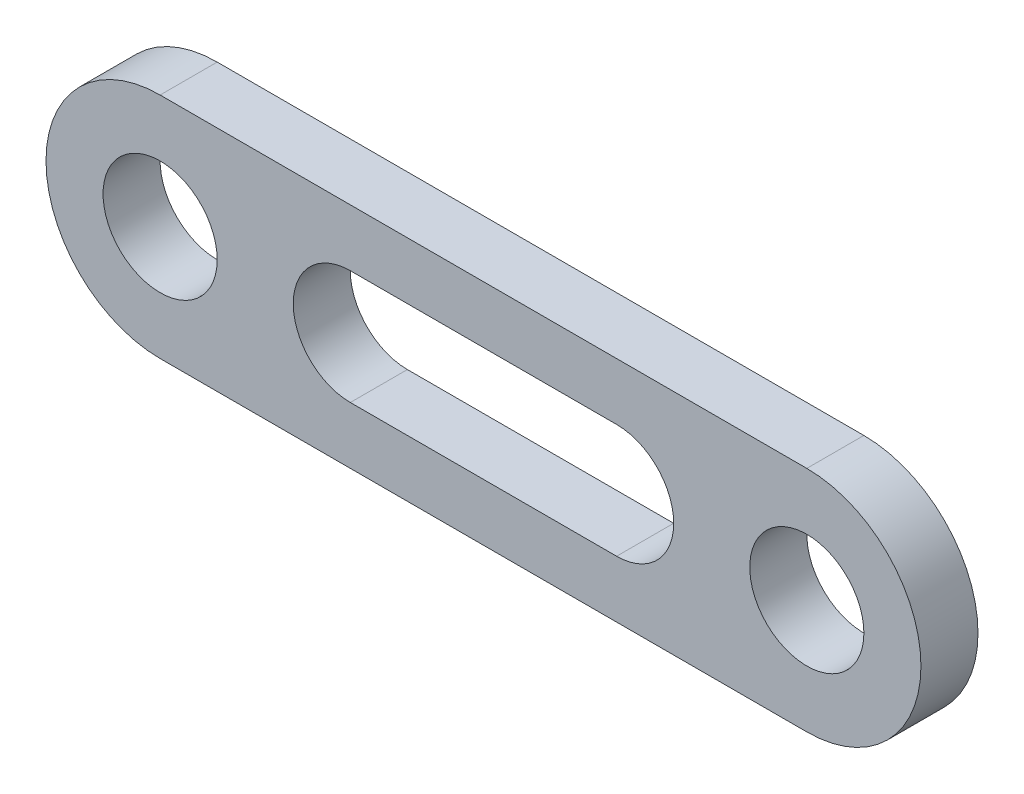
from build123d import *

# Parameters (mm, degrees)
SKETCH_2_R      = 3
EXTRUDE_1_DEPTH = 3


with BuildPart() as part:
    # 草图2 → 凸台-拉伸1 (new body)
    with BuildSketch(Plane.XY):
        with BuildLine():
            Line((0, 6), (34, 6))
            ThreePointArc((34, 6), (40, 0), (34, -6))
            Line((34, -6), (0, -6))
            ThreePointArc((0, -6), (-6, 0), (0, 6))
        make_face()
        Circle(SKETCH_2_R, mode=Mode.SUBTRACT)
        with Locations((34, 0)):
            Circle(SKETCH_2_R, mode=Mode.SUBTRACT)
        with BuildLine():
            Line((10, 3), (24, 3))
            ThreePointArc((24, 3), (27, 0), (24, -3))
            Line((24, -3), (10, -3))
            ThreePointArc((10, -3), (7, 0), (10, 3))
        make_face(mode=Mode.SUBTRACT)
    extrude(amount=EXTRUDE_1_DEPTH)


solid = part.part
